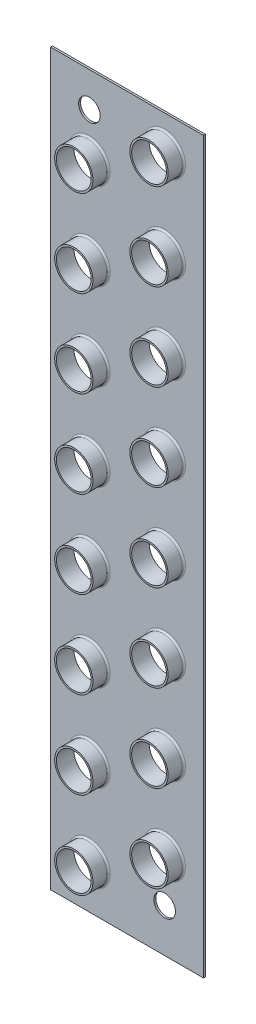
from build123d import *

# Parameters (mm, degrees)
SKETCH2_W              = 44
SKETCH2_H              = 210
BOSS_EXTRUDE1_DEPTH    = 0.55
SKETCH3_R              = 5
CUT_EXTRUDE1_DEPTH     = 215.560719844
BOSS_EXTRUDE2_START    = 4.5
SKETCH5_R              = 5.5
SKETCH5_R_2            = 5
BOSS_EXTRUDE2_DEPTH    = 4.5
FILLET1_R              = 0.5
LPATTERN1_COUNT        = 8
LPATTERN1_PITCH        = 25
FILLET1_OF_LPATTERN1_R = 0.5
SKETCH6_R              = 3.1
CUT_EXTRUDE2_DEPTH     = 215.619436445


with BuildPart() as part:
    # Sketch2 → Boss-Extrude1 (new body)
    with BuildSketch(Plane.XY):
        with Locations((22, -105)):
            Rectangle(SKETCH2_W, SKETCH2_H)
    extrude(amount=BOSS_EXTRUDE1_DEPTH)

    # Sketch3 → Cut-Extrude1 (cut, symmetric)
    with BuildSketch(Plane.XY.offset(0.55)):
        with Locations((11.174682453, -22.5)):
            Circle(SKETCH3_R)
        with Locations((32.825317547, -10)):
            Circle(SKETCH3_R)
    cut_extrude1 = extrude(amount=CUT_EXTRUDE1_DEPTH, both=True, mode=Mode.SUBTRACT)

    # Sketch5 → Boss-Extrude2 (add)
    # profile 1 of 2: a face of its own
    with BuildSketch(Plane.XY.offset(0.55).offset(BOSS_EXTRUDE2_START)):
        with Locations((11.174682453, -22.5)):
            Circle(SKETCH5_R)
        with Locations((11.174682453, -22.5)):
            Circle(SKETCH5_R_2, mode=Mode.SUBTRACT)
    # profile 2 of 2: a face of its own
    with BuildSketch(Plane.XY.offset(0.55).offset(BOSS_EXTRUDE2_START)):
        with Locations((32.825317547, -10)):
            Circle(SKETCH5_R)
        with Locations((32.825317547, -10)):
            Circle(SKETCH5_R_2, mode=Mode.SUBTRACT)
    boss_extrude2 = extrude(amount=-BOSS_EXTRUDE2_DEPTH)

    # Fillet1
    fillet1_edges = [part.edges().sort_by_distance(p)[0] for p in [
        (5.674682453, -22.5, 0.55),
        (27.325317547, -10, 0.55),
    ]]
    fillet(fillet1_edges, radius=FILLET1_R)

    # LPattern1: Cut-Extrude1, Boss-Extrude2 ×8
    with Locations(*[(0, -i * LPATTERN1_PITCH, 0) for i in range(1, LPATTERN1_COUNT)]):
        add(cut_extrude1, mode=Mode.SUBTRACT)
        add(boss_extrude2)

    # Fillet1 of LPattern1
    fillet1_of_lpattern1_edges = [part.edges().sort_by_distance(p)[0] for p in [
        (5.674682453, -47.5, 0.55),
        (27.325317547, -35, 0.55),
        (5.674682453, -72.5, 0.55),
        (27.325317547, -60, 0.55),
        (5.674682453, -97.5, 0.55),
        (27.325317547, -85, 0.55),
        (5.674682453, -122.5, 0.55),
        (27.325317547, -110, 0.55),
        (5.674682453, -147.5, 0.55),
        (27.325317547, -135, 0.55),
        (5.674682453, -172.5, 0.55),
        (27.325317547, -160, 0.55),
        (5.674682453, -197.5, 0.55),
        (27.325317547, -185, 0.55),
    ]]
    fillet(fillet1_of_lpattern1_edges, radius=FILLET1_OF_LPATTERN1_R)

    # Sketch6 → Cut-Extrude2 (cut, through all)
    with BuildSketch(Plane(origin=(0, 0, 0), x_dir=(-1, 0, 0), z_dir=(0, 0, -1))):
        with Locations((-11.174682453, -10)):
            Circle(SKETCH6_R)
        with Locations((-32.825317547, -197.5)):
            Circle(SKETCH6_R)
    extrude(amount=-CUT_EXTRUDE2_DEPTH, mode=Mode.SUBTRACT)


solid = part.part
